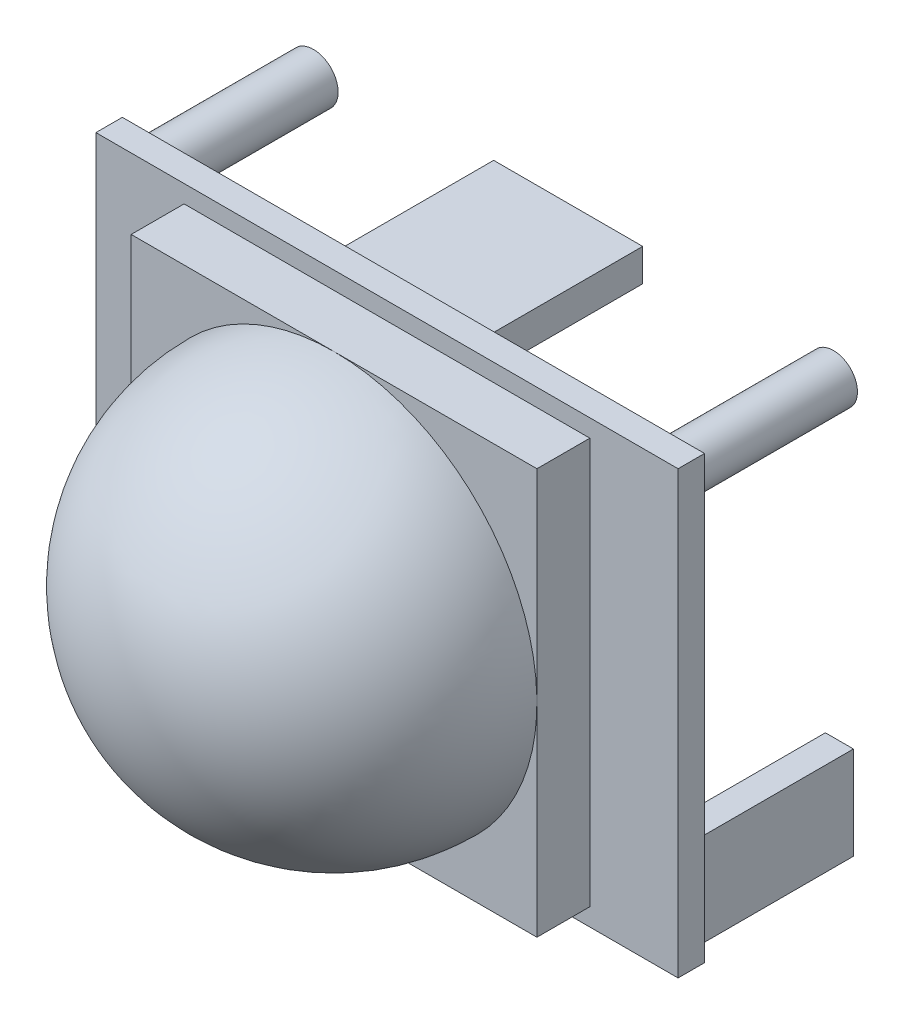
from build123d import *

# Parameters (mm, degrees)
SKETCH_1_W          = 33
SKETCH_1_H          = 25
EXTRUDE_1_DEPTH     = 10.5
SKETCH_2_W          = 23
SKETCH_2_H          = 23
EXTRUDE_2_DEPTH     = 3
SKETCH_4_W          = 33
SKETCH_4_H          = 25
SKETCH_4_R          = 1.35795949
SKETCH_4_R_2        = 1.399641029
SKETCH_4_R_3        = 1.333824315
SKETCH_4_R_4        = 1.35057922
SKETCH_4_W_2        = 8.447759406
SKETCH_4_H_2        = 1.838006231
SKETCH_4_W_3        = 1.590582314
SKETCH_4_H_3        = 5.266594776
SKETCH_4_W_4        = 6.114905344
SKETCH_4_H_4        = 2.244488378
SKETCH_4_W_5        = 5.69075006
CUT_EXTRUDE_1_DEPTH = 9


with BuildPart() as part:
    # Эскиз1 → Бобышка-Вытянуть1 (new body)
    with BuildSketch(Plane.XY):
        Rectangle(SKETCH_1_W, SKETCH_1_H)
    extrude(amount=EXTRUDE_1_DEPTH)

    # Эскиз2 → Бобышка-Вытянуть2 (add)
    with BuildSketch(Plane.XY.offset(10.5)):
        Rectangle(SKETCH_2_W, SKETCH_2_H)
    extrude(amount=EXTRUDE_2_DEPTH)

    # Эскиз4 → Вырез-Вытянуть1 (cut)
    with BuildSketch(Plane(origin=(0, 0, 0), x_dir=(-1, 0, 0), z_dir=(0, 0, -1))):
        Rectangle(SKETCH_4_W, SKETCH_4_H)
        with Locations((-14.810088665, 10.851306015)):
            Circle(SKETCH_4_R, mode=Mode.SUBTRACT)
        with Locations((14.668703571, 10.851306015)):
            Circle(SKETCH_4_R_2, mode=Mode.SUBTRACT)
        with Locations((-12.583273424, -10.99269111)):
            Circle(SKETCH_4_R_3, mode=Mode.SUBTRACT)
        with Locations((14.668703571, -10.921998562)):
            Circle(SKETCH_4_R_4, mode=Mode.SUBTRACT)
        with Locations((0.229750779, 10.99269111)):
            Rectangle(SKETCH_4_W_2, SKETCH_4_H_2, mode=Mode.SUBTRACT)
        with Locations((-15.145878265, -9.419781931)):
            Rectangle(SKETCH_4_W_3, SKETCH_4_H_3, mode=Mode.SUBTRACT)
        with Locations((-2.350527199, -10.54202612)):
            Rectangle(SKETCH_4_W_4, SKETCH_4_H_4, mode=Mode.SUBTRACT)
        with Locations((5.708423197, -10.54202612)):
            Rectangle(SKETCH_4_W_5, SKETCH_4_H_4, mode=Mode.SUBTRACT)
    extrude(amount=-CUT_EXTRUDE_1_DEPTH, mode=Mode.SUBTRACT)


with BuildPart() as body_2:
    # Эскиз3 → Повернуть1 (revolve)
    with BuildSketch(Plane(origin=(0, 0, 0), x_dir=(0, 0, -1), z_dir=(1, 0, 0)), mode=Mode.PRIVATE) as revolve_1_sk:
        with BuildLine():
            Line((-25.037873178, 0), (-13.537811019, 0))
            Line((-13.537811019, 0), (-13.5, 11.5))
            ThreePointArc((-13.5, 11.5), (-21.656203736, 8.145129181), (-25.037873178, 0))
        make_face()
    revolve(revolve_1_sk.sketch.rotate(Axis((0, 0, -2.745901425), (0, 0, 1)), 90), axis=Axis((0, 0, -2.745901425), (0, 0, 1)))


solid = Compound([part.part, body_2.part])
